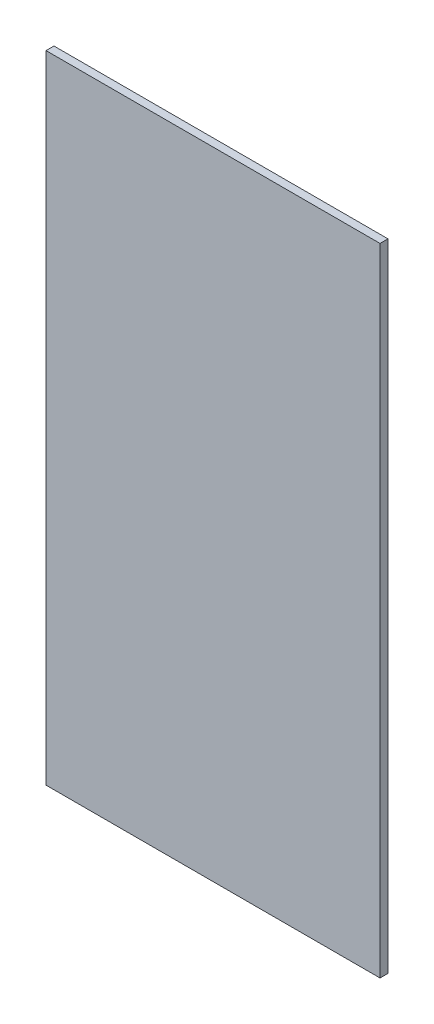
from build123d import *

# Parameters (mm, degrees)
SKETCH1_W           = 3150
SKETCH1_H           = 6000
BOSS_EXTRUDE1_DEPTH = 75


with BuildPart() as part:
    # Sketch1 → Boss-Extrude1 (new body)
    with BuildSketch(Plane.XY):
        Rectangle(SKETCH1_W, SKETCH1_H)
    extrude(amount=BOSS_EXTRUDE1_DEPTH)


solid = part.part
